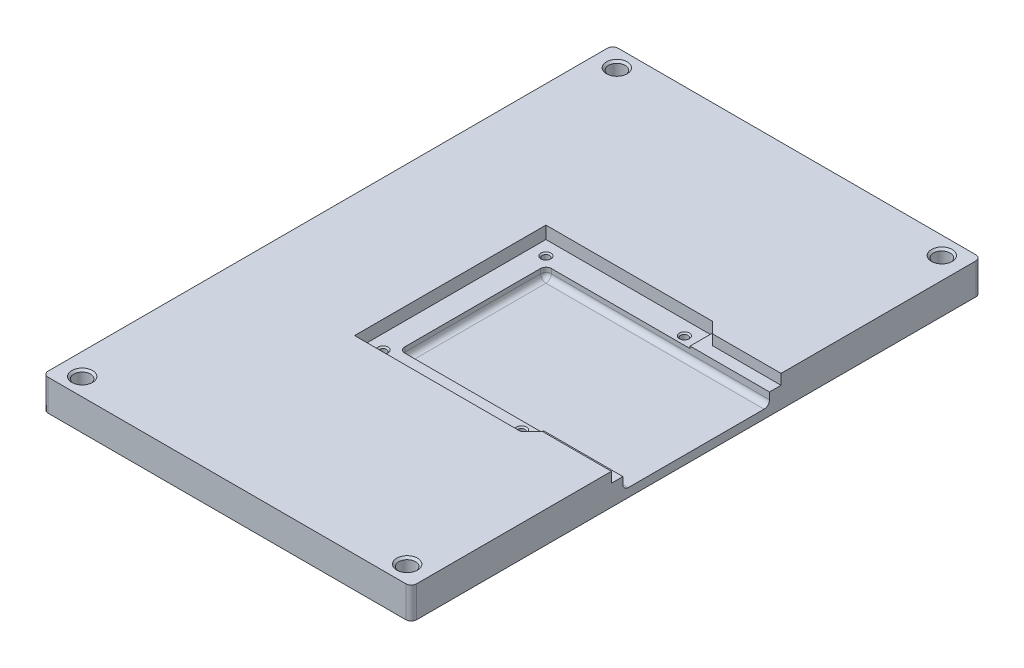
from build123d import *

# Parameters (mm, degrees)
BOSS_EXTRUDE1_DEPTH     = 11.5
SKETCH4_R               = 3.075
CUT_EXTRUDE1_DEPTH      = 6
CUT_EXTRUDE6_DEPTH      = 4.6
CUT_EXTRUDE3_DEPTH      = 126.21831186
CUT_EXTRUDE3_DEPTH_BACK = 3.7
SKETCH24_W              = 82.375
SKETCH24_H              = 54
SKETCH25_R              = 1.35
CUT_EXTRUDE4_DEPTH      = 5
CHAMFER4_SIZE           = 0.5
FILLET1_R               = 2
BOSS_EXTRUDE2_DEPTH     = 0.8
CHAMFER5_SIZE           = 0.75


with BuildPart() as part:
    # Sketch1 → Boss-Extrude1 (new body)
    with BuildSketch(Plane(origin=(0, 0, 0), x_dir=(1, 0, 0), z_dir=(0, 1, 0))):
        with BuildLine():
            Line((-67.875, 90), (-67.875, -90))
            Line((-67.875, -90), (-67.875, -103))
            ThreePointArc((-67.875, -103), (-67.289213562, -104.414213562), (-65.875, -105))
            Line((-65.875, -105), (65.875, -105))
            ThreePointArc((65.875, -105), (67.289213562, -104.414213562), (67.875, -103))
            Line((67.875, -103), (67.875, -90))
            Line((67.875, -90), (67.875, 90))
            Line((67.875, 90), (67.875, 103))
            ThreePointArc((67.875, 103), (67.289213562, 104.414213562), (65.875, 105))
            Line((65.875, 105), (-65.875, 105))
            ThreePointArc((-65.875, 105), (-67.289213562, 104.414213562), (-67.875, 103))
            Line((-67.875, 103), (-67.875, 90))
        make_face()
    extrude(amount=BOSS_EXTRUDE1_DEPTH)

    # Sketch4 → Cut-Extrude1 (cut)
    with BuildSketch(Plane(origin=(0, 11.5, 0), x_dir=(1, 0, 0), z_dir=(0, 1, 0))):
        with Locations(Location((-59.875, -98.5, 0), (0, 0, 270))):
            Circle(SKETCH4_R)
        with Locations(Location((59.875, -98.5, 0), (0, 0, 270))):
            Circle(SKETCH4_R)
        with Locations(Location((59.875, 98.5, 0), (0, 0, 270))):
            Circle(SKETCH4_R)
        with Locations(Location((-59.875, 98.5, 0), (0, 0, 270))):
            Circle(SKETCH4_R)
    extrude(amount=-CUT_EXTRUDE1_DEPTH, mode=Mode.SUBTRACT)

    # Sketch21 → Cut-Extrude6 (cut)
    with BuildSketch(Plane(origin=(0, 11.5, 0), x_dir=(1, 0, 0), z_dir=(0, 1, 0))):
        Polygon((67.875, 31), (67.875, -31), (67.875, -31.25), (42.603553391, -31.25), (38.603553391, -35.25), (-22.75, -35.25), (-22.75, 35.25), (38.603553391, 35.25), (42.603553391, 31.25), (67.875, 31.25), align=None)
    extrude(amount=-CUT_EXTRUDE6_DEPTH, mode=Mode.SUBTRACT)

    # Sketch24 → Cut-Extrude3 (cut, two sides: drawn at the far end of the back side and taken through both)
    with BuildSketch(Plane(origin=(0, 6.9, 0), x_dir=(1, 0, 0), z_dir=(0, 1, 0)).offset(-CUT_EXTRUDE3_DEPTH_BACK)):
        with Locations((26.6875, 0)):
            Rectangle(SKETCH24_W, SKETCH24_H)
    extrude(amount=CUT_EXTRUDE3_DEPTH + CUT_EXTRUDE3_DEPTH_BACK, mode=Mode.SUBTRACT)

    # Sketch25 → Cut-Extrude4 (cut)
    with BuildSketch(Plane(origin=(0, 6.9, 0), x_dir=(1, 0, 0), z_dir=(0, 1, 0))):
        with Locations(Location((33.5, 30, 0), (0, 0, 270))):
            Circle(SKETCH25_R)
        with Locations(Location((-17.5, 30, 0), (0, 0, 270))):
            Circle(SKETCH25_R)
        with Locations(Location((33.5, -30, 0), (0, 0, 270))):
            Circle(SKETCH25_R)
        with Locations(Location((-17.5, -30, 0), (0, 0, 270))):
            Circle(SKETCH25_R)
    extrude(amount=-CUT_EXTRUDE4_DEPTH, mode=Mode.SUBTRACT)

    # Chamfer4
    chamfer4_edges = [part.edges().sort_by_distance(p)[0] for p in [
        (-17.5, 6.9, -31.35),
        (33.5, 6.9, 28.65),
        (-17.5, 6.9, 28.65),
        (33.5, 6.9, -31.35),
    ]]
    chamfer(chamfer4_edges, length=CHAMFER4_SIZE)

    # Fillet1
    fillet1_edges = [part.edges().sort_by_distance(p)[0] for p in [
        (26.6875, 3.2, -27),
        (-14.5, 5.05, -27),
        (-14.5, 3.2, 0),
        (-14.5, 5.05, 27),
        (26.6875, 3.2, 27),
    ]]
    fillet(fillet1_edges, radius=FILLET1_R)

    # Sketch26 → Boss-Extrude2 (add)
    with BuildSketch(Plane(origin=(0, 6.9, 0), x_dir=(1, 0, 0), z_dir=(0, 1, 0))):
        Polygon((38.603553391, 35.25), (38.603553391, 27), (67.875, 27), (67.875, 31.25), (42.603553391, 31.25), align=None)
        Polygon((42.603553391, -31.25), (38.603553391, -35.25), (38.603553391, -27), (67.875, -27), (67.875, -31.25), align=None)
    extrude(amount=BOSS_EXTRUDE2_DEPTH)

    # Chamfer5
    chamfer5_edges = [part.edges().sort_by_distance(p)[0] for p in [
        (-59.875, 11.5, -101.575),
        (59.875, 11.5, -101.575),
        (59.875, 11.5, 95.425),
        (-59.875, 11.5, 95.425),
    ]]
    chamfer(chamfer5_edges, length=CHAMFER5_SIZE)


solid = part.part
